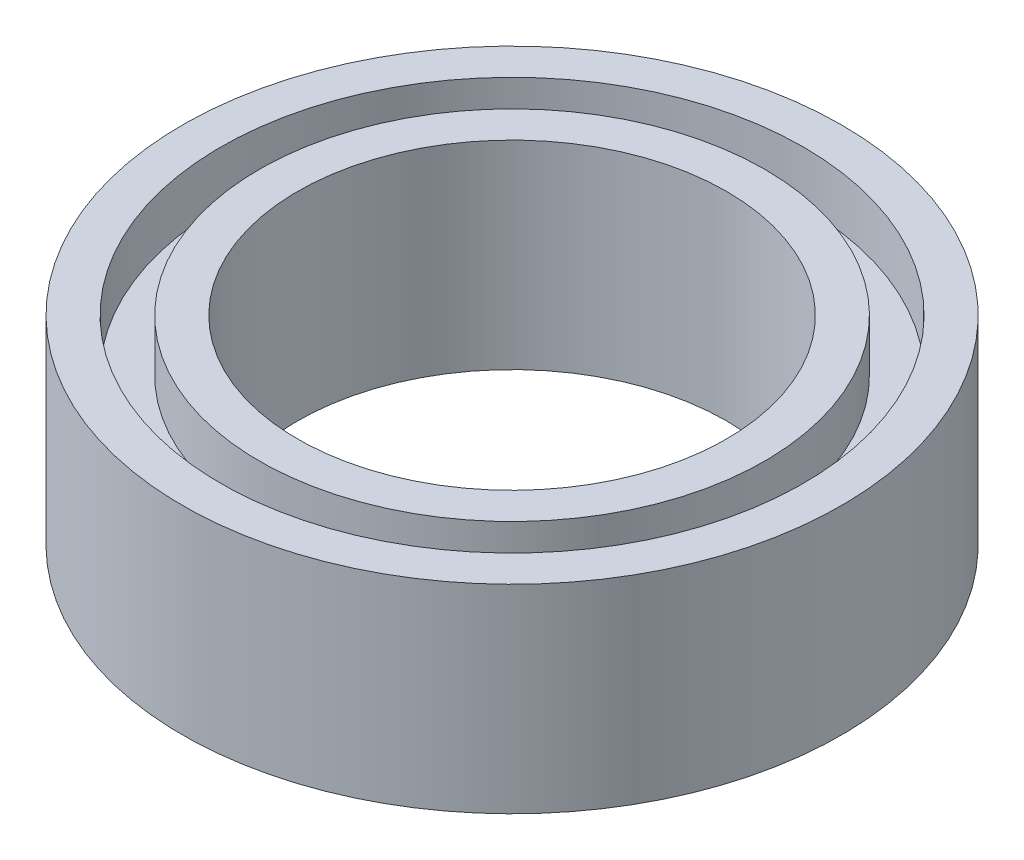
from build123d import *


with BuildPart() as part:
    # Sketch1 → Revolve1 (revolve)
    with BuildSketch(Plane.XY, mode=Mode.PRIVATE) as revolve1_sk:
        Polygon((5.569387755, 6.096608289), (6.3, 6.096608289), (6.3, 9.896608289), (5.569387755, 9.896608289), (5.569387755, 8.896608289), (4.830612245, 8.896608289), (4.830612245, 9.896608289), (4.1, 9.896608289), (4.1, 6.096608289), (4.830612245, 6.096608289), (4.830612245, 7.096608289), (5.569387755, 7.096608289), align=None)
    revolve(revolve1_sk.sketch.rotate(Axis((0, -13.159735934, 0), (0, 1, 0)), 90), axis=Axis((0, -13.159735934, 0), (0, 1, 0)))


solid = part.part
